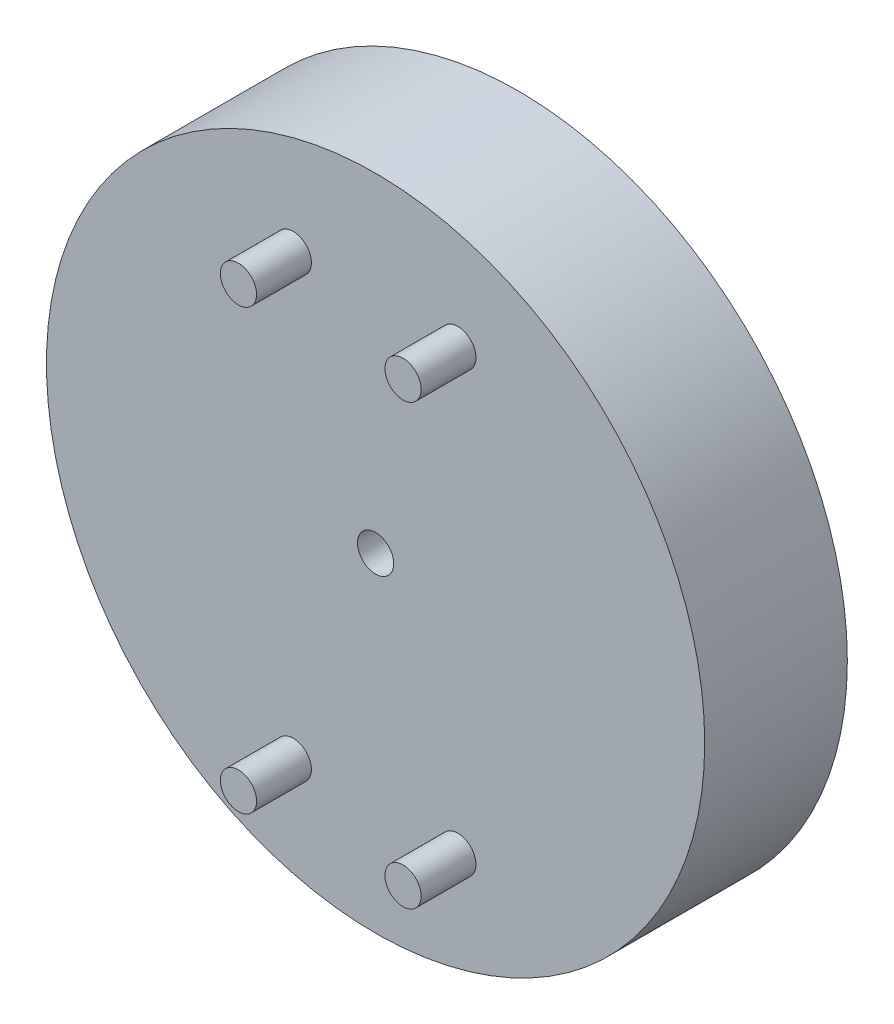
from build123d import *

# Parameters (mm, degrees)
SKETCH_1_R      = 60
SKETCH_1_R_2    = 3.3
EXTRUDE_1_DEPTH = 26
SKETCH_2_R      = 3.3
EXTRUDE_2_DEPTH = 36


with BuildPart() as part:
    # 草图1 → 凸台-拉伸1 (new body)
    with BuildSketch(Plane.XY.offset(6)):
        Circle(SKETCH_1_R)
        Circle(SKETCH_1_R_2, mode=Mode.SUBTRACT)
    extrude(amount=-EXTRUDE_1_DEPTH)

    # 草图2 → 凸台-拉伸2 (add)
    with BuildSketch(Plane(origin=(0, 0, -20), x_dir=(-1, 0, 0), z_dir=(0, 0, -1))):
        with Locations((-14.999999495, 40)):
            Circle(SKETCH_2_R)
        with Locations((14.999999495, 40)):
            Circle(SKETCH_2_R)
        with Locations((-14.999999495, -40)):
            Circle(SKETCH_2_R)
        with Locations((14.999999495, -40)):
            Circle(SKETCH_2_R)
    extrude(amount=-EXTRUDE_2_DEPTH)


solid = part.part
